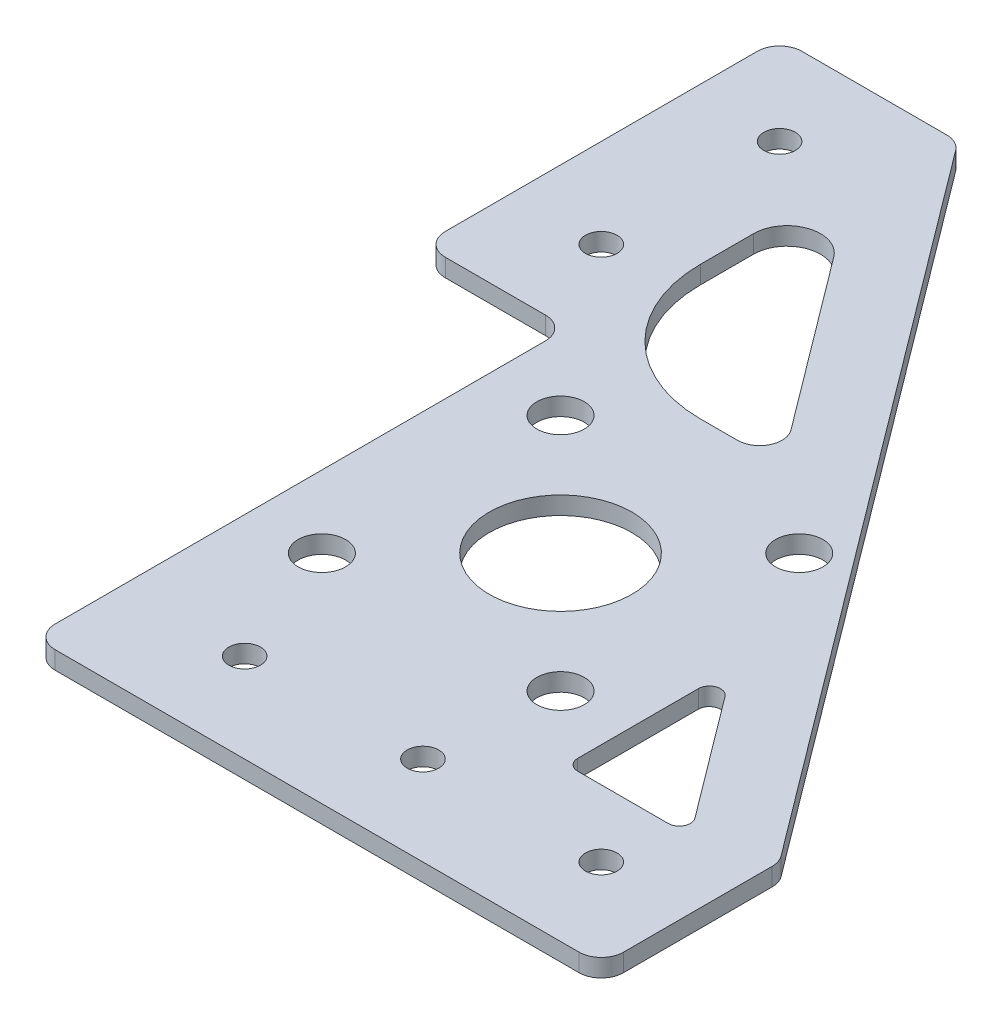
from build123d import *

# Parameters (mm, degrees)
BOSS_EXTRUDE1_DEPTH     = 2.54
F_8_CLEARANCE_HOLE1_D   = 4.4958
F_1_4_CLEARANCE_HOLE1_D = 6.7564
SKETCH6_R               = 10.16
CUT_EXTRUDE1_DEPTH      = 163.659188489


with BuildPart() as part:
    # Sketch1 → Boss-Extrude1 (new body)
    with BuildSketch(Plane(origin=(0, 0, 0), x_dir=(1, 0, 0), z_dir=(0, 1, 0))):
        with BuildLine():
            Line((26.3525, 125.73), (100.965, 26.246666667))
            ThreePointArc((100.965, 26.246666667), (101.437069471, 25.345689824), (101.6, 24.341666667))
            Line((101.6, 24.341666667), (101.6, 3.175))
            ThreePointArc((101.6, 3.175), (100.67006403, 0.92993597), (98.425, 0))
            Line((98.425, 0), (23.8125, 0))
            ThreePointArc((23.8125, 0), (21.56743597, 0.92993597), (20.6375, 3.175))
            Line((20.6375, 3.175), (20.6375, 73.025))
            ThreePointArc((20.6375, 73.025), (19.70756403, 75.27006403), (17.4625, 76.2))
            Line((17.4625, 76.2), (3.175, 76.2))
            ThreePointArc((3.175, 76.2), (0.92993597, 77.12993597), (0, 79.375))
            Line((0, 79.375), (0, 123.825))
            ThreePointArc((0, 123.825), (0.92993597, 126.07006403), (3.175, 127))
            Line((3.175, 127), (23.8125, 127))
            ThreePointArc((23.8125, 127), (25.232403166, 126.664806331), (26.3525, 125.73))
        make_face()
    extrude(amount=BOSS_EXTRUDE1_DEPTH)

    # #8 Clearance Hole1 (through all)
    with Locations(Plane.XZ):
        with Locations((38.1, -12.7), (63.5, -12.7), (88.9, -12.7), (12.7, -88.9), (12.7, -114.3)):
            Hole(F_8_CLEARANCE_HOLE1_D / 2)

    # 1/4 Clearance Hole1 (through all)
    with Locations(Plane.XZ):
        with Locations((30.9, -64.9), (30.9, -30.9), (64.9, -30.9), (64.9, -64.9)):
            Hole(F_1_4_CLEARANCE_HOLE1_D / 2)

    # Sketch6 → Cut-Extrude1 (cut, through all)
    with BuildSketch(Plane.XZ):
        with Locations(Location((47.9, -47.9, 0), (0, 0, 270))):
            Circle(SKETCH6_R)
        with BuildLine():
            Line((76.0125, -22.225), (88.9, -22.225))
            ThreePointArc((88.9, -22.225), (90.319903166, -23.102548417), (90.17, -24.765))
            Line((90.17, -24.765), (77.2825, -41.948333333))
            ThreePointArc((77.2825, -41.948333333), (75.510488421, -42.501868069), (74.425, -40.995833333))
            Line((74.425, -40.995833333), (74.425, -23.8125))
            ThreePointArc((74.425, -23.8125), (74.889967985, -22.689967985), (76.0125, -22.225))
        make_face()
        with BuildLine():
            Line((30.7975, -103.928333333), (49.115, -79.505))
            ThreePointArc((49.115, -79.505), (49.414806331, -76.180096834), (46.575, -74.425))
            Line((46.575, -74.425), (41.275, -74.425))
            ThreePointArc((41.275, -74.425), (27.804615818, -80.004615818), (22.225, -93.475))
            Line((22.225, -93.475), (22.225, -101.070833333))
            ThreePointArc((22.225, -101.070833333), (25.481465264, -105.58893754), (30.7975, -103.928333333))
        make_face()
    extrude(amount=-CUT_EXTRUDE1_DEPTH, mode=Mode.SUBTRACT)


solid = part.part
